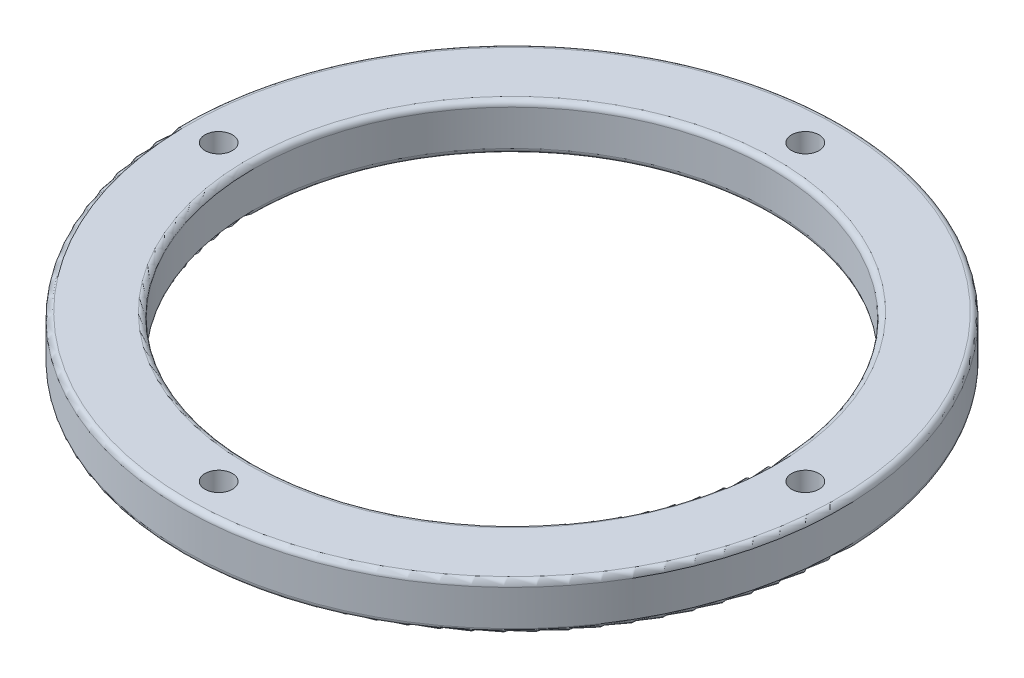
from build123d import *

# Parameters (mm, degrees)
SKETCH1_R           = 60
SKETCH1_R_2         = 47.1
SKETCH1_R_3         = 2.5
BOSS_EXTRUDE1_DEPTH = 8.5
FILLET1_R           = 1


with BuildPart() as part:
    # Sketch1 → Boss-Extrude1 (new body)
    with BuildSketch(Plane(origin=(0, 0, 0), x_dir=(1, 0, 0), z_dir=(0, 1, 0))):
        with Locations(Location((0, 0, 0), (0, 0, 270))):
            Circle(SKETCH1_R)
        with Locations(Location((0, 0, 0), (0, 0, 270))):
            Circle(SKETCH1_R_2, mode=Mode.SUBTRACT)
        with Locations(Location((0, 53.4, 0), (0, 0, 270))):
            Circle(SKETCH1_R_3, mode=Mode.SUBTRACT)
        with Locations(Location((53.4, 0, 0), (0, 0, 270))):
            Circle(SKETCH1_R_3, mode=Mode.SUBTRACT)
        with Locations(Location((0, -53.4, 0), (0, 0, 270))):
            Circle(SKETCH1_R_3, mode=Mode.SUBTRACT)
        with Locations(Location((-53.4, 0, 0), (0, 0, 270))):
            Circle(SKETCH1_R_3, mode=Mode.SUBTRACT)
    extrude(amount=BOSS_EXTRUDE1_DEPTH)

    # Fillet1
    fillet1_edges = [part.edges().sort_by_distance(p)[0] for p in [
        (0, 0, -60),
        (0, 8.5, -60),
        (0, 0, -47.1),
        (0, 8.5, -47.1),
    ]]
    fillet(fillet1_edges, radius=FILLET1_R)


solid = part.part
